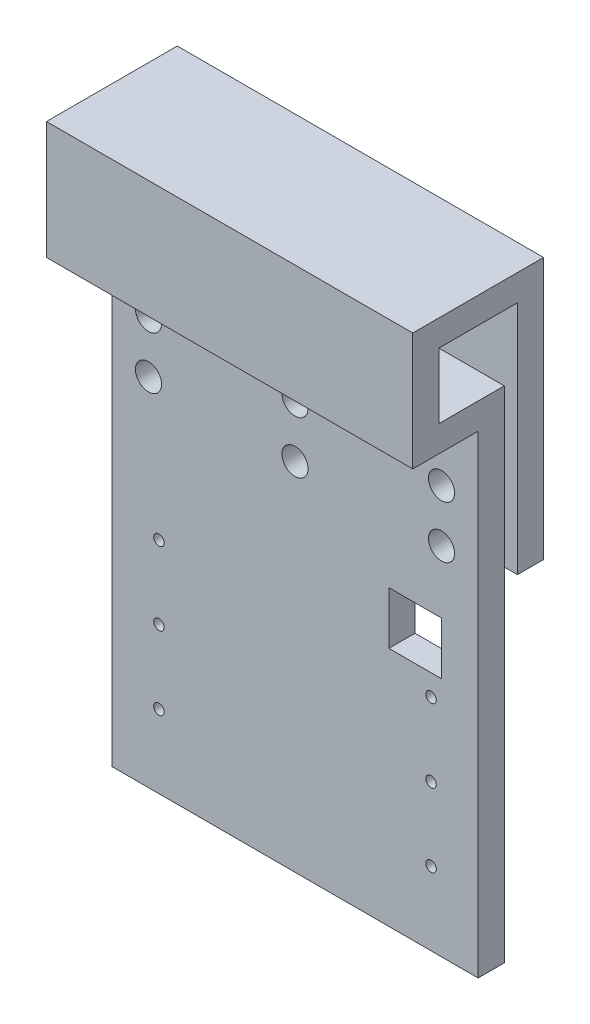
from build123d import *

# Parameters (mm, degrees)
BOSS_EXTRUDE1_DEPTH = 88.9
SKETCH2_R           = 3.175
SKETCH2_R_2         = 1.27
SKETCH2_W           = 12.784255415
SKETCH2_H           = 12.760259732
CUT_EXTRUDE1_DEPTH  = 81.28


with BuildPart() as part:
    # Sketch1 → Boss-Extrude1 (new body)
    with BuildSketch(Plane(origin=(0, 0, 0), x_dir=(0, 0, -1), z_dir=(1, 0, 0))):
        Polygon((6.35, 11.43), (6.35, -71.755), (0, -71.755), (0, 11.43), (0, 43.18), (-15.875, 43.18), (-15.875, 71.755), (15.875, 71.755), (15.875, 8.255), (9.525, 8.255), (9.525, 65.405), (-9.525, 65.405), (-9.525, 49.53), (6.35, 49.53), align=None)
    extrude(amount=BOSS_EXTRUDE1_DEPTH)

    # Sketch2 → Cut-Extrude1 (cut)
    with BuildSketch(Plane(origin=(0, 0, -15.875), x_dir=(-1, 0, 0), z_dir=(0, 0, -1))):
        with Locations(Location((-44.45, 27.305, 0), (0, 0, 90))):
            Circle(SKETCH2_R)
        with Locations(Location((-80.01, 27.305, 0), (0, 0, 90))):
            Circle(SKETCH2_R)
        with Locations(Location((-80.01, 14.605, 0), (0, 0, 90))):
            Circle(SKETCH2_R)
        with Locations(Location((-44.45, 14.605, 0), (0, 0, 90))):
            Circle(SKETCH2_R)
        with Locations(Location((-8.89, 14.605, 0), (0, 0, 90))):
            Circle(SKETCH2_R)
        with Locations(Location((-8.89, 27.305, 0), (0, 0, 90))):
            Circle(SKETCH2_R)
        with Locations(Location((-77.47, -18.415, 0), (0, 0, 90))):
            Circle(SKETCH2_R_2)
        with Locations(Location((-77.47, -36.195, 0), (0, 0, 90))):
            Circle(SKETCH2_R_2)
        with Locations(Location((-77.47, -53.975, 0), (0, 0, 90))):
            Circle(SKETCH2_R_2)
        with Locations(Location((-11.43, -53.975, 0), (0, 0, 90))):
            Circle(SKETCH2_R_2)
        with Locations(Location((-11.43, -36.195, 0), (0, 0, 90))):
            Circle(SKETCH2_R_2)
        with Locations(Location((-11.43, -18.415, 0), (0, 0, 90))):
            Circle(SKETCH2_R_2)
        with Locations((-73.617872293, -6.922794841)):
            Rectangle(SKETCH2_W, SKETCH2_H)
    extrude(amount=-CUT_EXTRUDE1_DEPTH, mode=Mode.SUBTRACT)


solid = part.part
